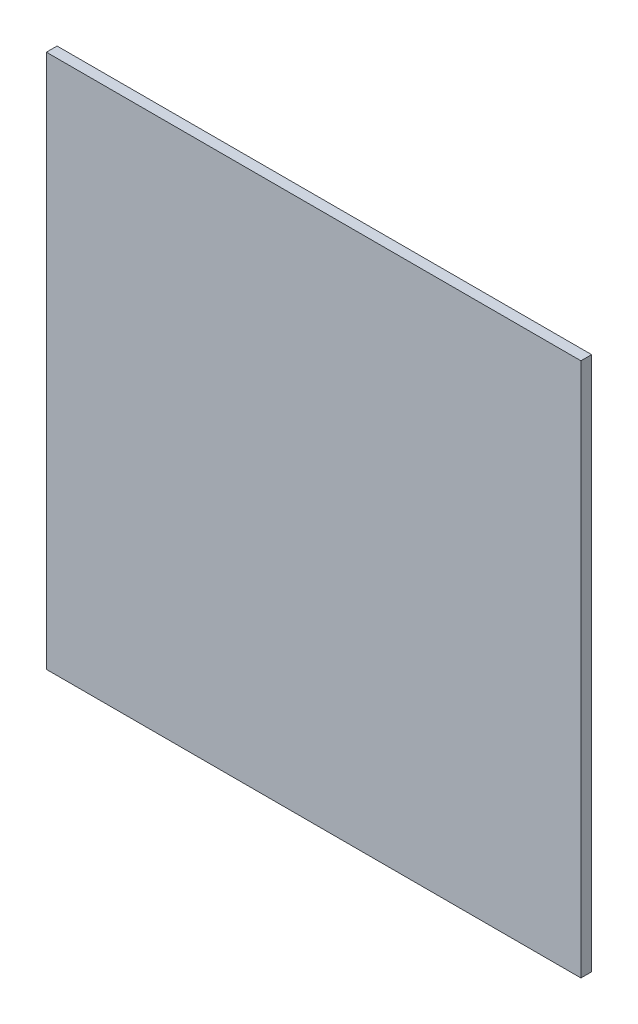
from build123d import *

# Parameters (mm, degrees)
SKETCH1_W           = 19.05
SKETCH1_H           = 19.05
BOSS_EXTRUDE1_DEPTH = 0.381


with BuildPart() as part:
    # Sketch1 → Boss-Extrude1 (new body)
    with BuildSketch(Plane.XY):
        Rectangle(SKETCH1_W, SKETCH1_H)
    extrude(amount=BOSS_EXTRUDE1_DEPTH)


solid = part.part
